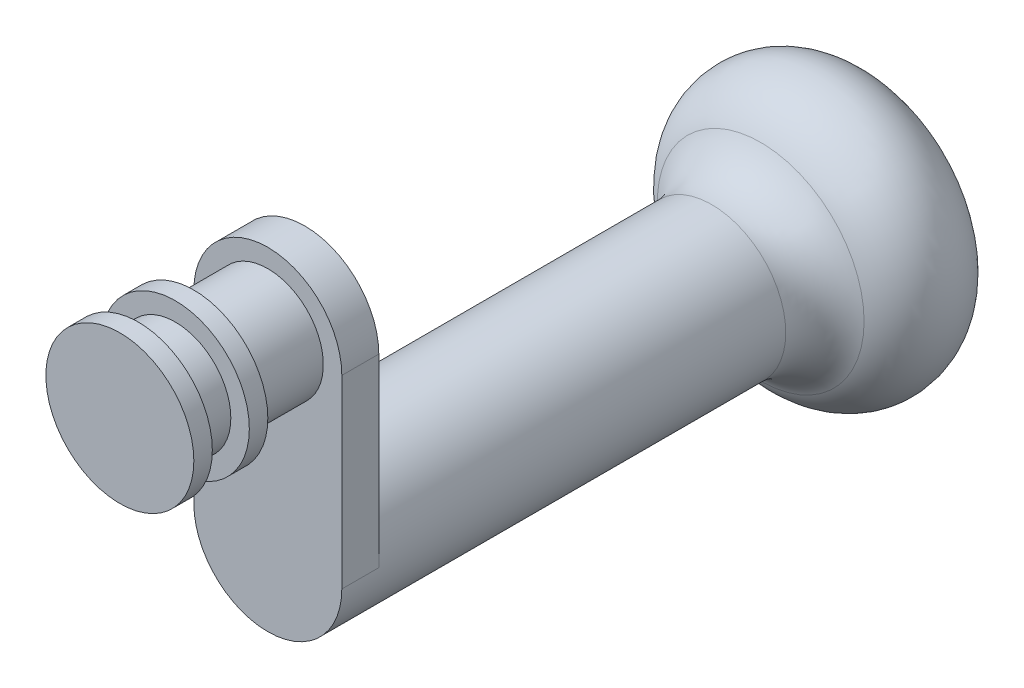
from build123d import *

# Parameters (mm, degrees)
SKETCH1_R           = 7.5
BOSS_EXTRUDE1_DEPTH = 25
SKETCH2_R           = 10
BOSS_EXTRUDE2_DEPTH = 2.5
BOSS_EXTRUDE3_START = -7.5
SKETCH2_2_R         = 10
BOSS_EXTRUDE3_DEPTH = 2.5
BOSS_EXTRUDE4_START = -5
BOSS_EXTRUDE4_DEPTH = 5
SKETCH5_R           = 10
BOSS_EXTRUDE5_DEPTH = 57.5


with BuildPart() as part:
    # Sketch1 → Boss-Extrude1 (new body)
    with BuildSketch(Plane.XY):
        Circle(SKETCH1_R)
    extrude(amount=BOSS_EXTRUDE1_DEPTH)

    # Sketch2 → Boss-Extrude2 (add)
    with BuildSketch(Plane.XY.offset(25)):
        Circle(SKETCH2_R)
    extrude(amount=-BOSS_EXTRUDE2_DEPTH)

    # Sketch2<2> → Boss-Extrude3 (add)
    with BuildSketch(Plane.XY.offset(25).offset(BOSS_EXTRUDE3_START)):
        Circle(SKETCH2_2_R)
    extrude(amount=-BOSS_EXTRUDE3_DEPTH)

    # Sketch4 → Boss-Extrude4 (add)
    with BuildSketch(Plane(origin=(0, 0, 0), x_dir=(-1, 0, 0), z_dir=(0, 0, -1)).offset(BOSS_EXTRUDE4_START)):
        with BuildLine():
            Line((-10, 0), (-10, -25))
            ThreePointArc((-10, -25), (0, -35), (10, -25))
            Line((10, -25), (10, 0))
            ThreePointArc((10, 0), (0, 10), (-10, 0))
        make_face()
    extrude(amount=BOSS_EXTRUDE4_DEPTH)

    # Sketch5 → Boss-Extrude5 (add)
    with BuildSketch(Plane.XY.offset(5)):
        with Locations((0, -25)):
            Circle(SKETCH5_R)
    extrude(amount=-BOSS_EXTRUDE5_DEPTH)

    # Sketch6 → Revolve1 (revolve)
    with BuildSketch(Plane(origin=(0, 0, 0), x_dir=(0, 0, -1), z_dir=(1, 0, 0)), mode=Mode.PRIVATE) as revolve1_sk:
        with BuildLine():
            Line((52.5, -25), (77.5, -25))
            Line((77.5, -25), (77.5, -15))
            ThreePointArc((77.5, -15), (71.108894336, -6.814422655), (61.617647059, -11.029411765))
            ThreePointArc((61.617647059, -11.029411765), (58.858718166, -13.931196943), (55, -15))
            Line((55, -15), (52.5, -15))
            Line((52.5, -15), (52.5, -25))
        make_face()
    revolve(revolve1_sk.sketch.rotate(Axis((0, -25, -52.5), (0, 0, -1)), 90), axis=Axis((0, -25, -52.5), (0, 0, -1)))


solid = part.part
